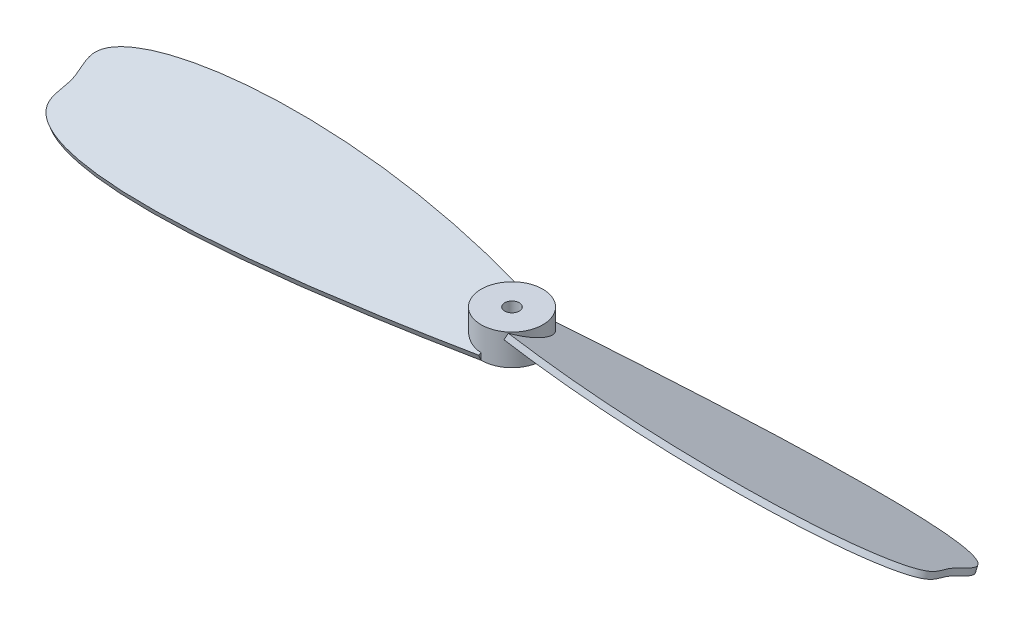
from build123d import *

# Parameters (mm, degrees)
SKETCH1_R           = 6.35
SKETCH1_R_2         = 1.5
BOSS_EXTRUDE1_DEPTH = 6.35
BOSS_EXTRUDE2_DEPTH = 1.27
CIRPATTERN1_COUNT   = 2
SKETCH6_R           = 1.5
CUT_EXTRUDE7_DEPTH  = 91.638322024


with BuildPart() as part:
    # Sketch1 → Boss-Extrude1 (new body)
    with BuildSketch(Plane(origin=(0, 0, 0), x_dir=(1, 0, 0), z_dir=(0, 1, 0))):
        with Locations(Location((0, 0, 0), (0, 0, 270))):
            Circle(SKETCH1_R)
        with Locations(Location((0, 0, 0), (0, 0, 270))):
            Circle(SKETCH1_R_2, mode=Mode.SUBTRACT)
    extrude(amount=BOSS_EXTRUDE1_DEPTH)

    # Sketch5 → Boss-Extrude2 (add)
    with BuildSketch(Plane(origin=(0, 2.283903866, -0.969459674), x_dir=(-1, 0, 0), z_dir=(0, 0.9205048534524427, -0.39073112848926805))):
        with BuildLine():
            Line((0, -5.845205819), (0, 5.845205819))
            add(Edge.make_bspline(
                [(0, 5.845205819), (-43.236705744, 17.099647121), (-94.2907228, 12.951703411), (-88.061726505, -0.009433869), (-92.616159199, -10.411025475), (-66.821854292, -15.476429188), (0, -5.845205819)],
                knots=[0, 0, 0, 0, 0.469261671, 0.561898963, 0.654536254, 1, 1, 1, 1], degree=3))
        make_face()
    boss_extrude2 = extrude(amount=BOSS_EXTRUDE2_DEPTH)

    # CirPattern1: Boss-Extrude2 ×2 about axis
    cirpattern1_axis = Axis((0, 6.35, 0), (0, 1, 0))
    for i in range(1, CIRPATTERN1_COUNT):
        add(boss_extrude2.rotate(cirpattern1_axis, i * 360 / CIRPATTERN1_COUNT))

    # Sketch6 → Cut-Extrude7 (cut, through all)
    with BuildSketch(Plane.XZ):
        with Locations(Location((0, 0, 0), (0, 0, 90))):
            Circle(SKETCH6_R)
    extrude(amount=-CUT_EXTRUDE7_DEPTH, mode=Mode.SUBTRACT)


solid = part.part
